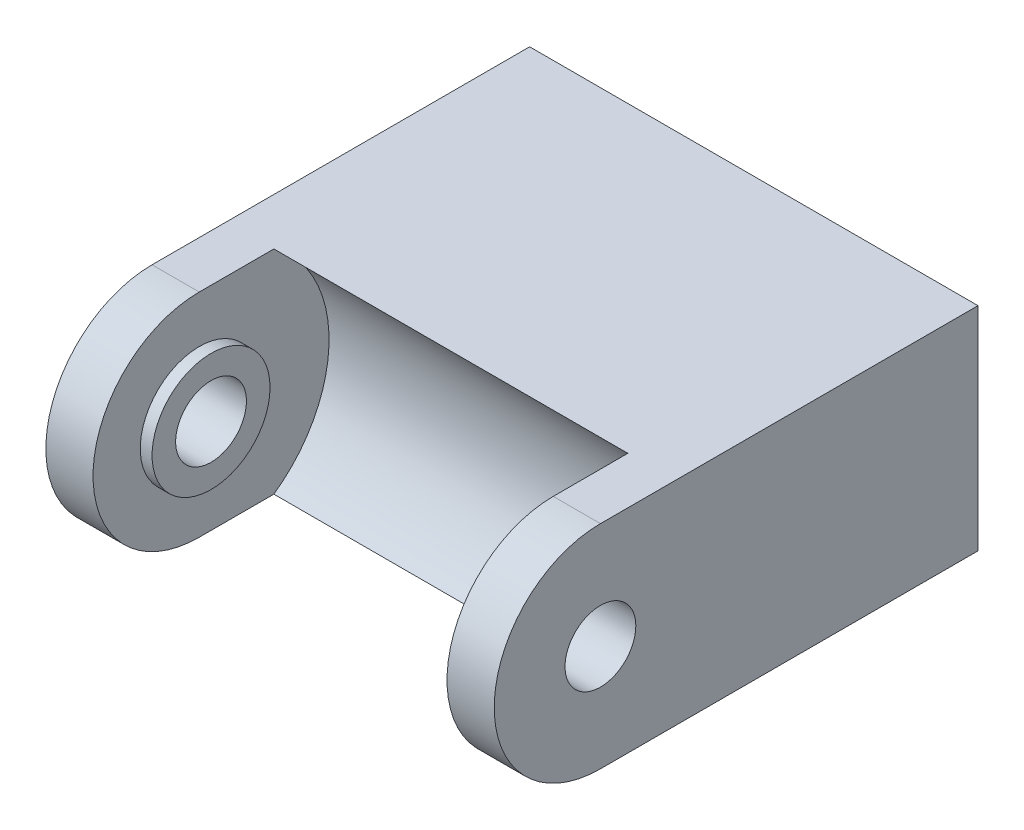
from build123d import *
from build123d.topology import SkipClean

# Parameters (mm, degrees)
EXTRUDE_1_DEPTH          = 9.5
EXTRUDE_1_DEPTH_BACK     = 9.5
CUT_EXTRUDE_1_DEPTH      = 7
CUT_EXTRUDE_1_DEPTH_BACK = 7
SKETCH_2_R               = 5.5
CUT_EXTRUDE_2_DEPTH      = 20.144189719
CUT_EXTRUDE_2_DEPTH_BACK = 20.144189719
SKETCH_3_R               = 1.5
CUT_EXTRUDE_3_DEPTH      = 7.5
CUT_EXTRUDE_3_DEPTH_BACK = 7.5
SKETCH_4_R               = 5.5
SKETCH_4_R_2             = 2.5
SKETCH_5_R               = 1.75
CUT_EXTRUDE_4_DEPTH      = 2


with BuildPart() as part:
    # Эскиз1 → Бобышка-Вытянуть1 (new, two sides: drawn at the far end of the back side and taken through both)
    with BuildSketch(Plane(origin=(0, 0, 0), x_dir=(0, 0, -1), z_dir=(1, 0, 0)).offset(-EXTRUDE_1_DEPTH_BACK)):
        with BuildLine():
            Line((16, 4.5), (0, 4.5))
            ThreePointArc((0, 4.5), (-4.5, 0), (0, -4.5))
            Line((0, -4.5), (16, -4.5))
            Line((16, -4.5), (16, 4.5))
        make_face()
    extrude(amount=EXTRUDE_1_DEPTH + EXTRUDE_1_DEPTH_BACK)

    # Эскиз2 → Вырез-Вытянуть1 (cut, two sides: drawn at the far end of the back side and taken through both)
    with BuildSketch(Plane(origin=(0, 0, 0), x_dir=(0, 0, -1), z_dir=(1, 0, 0)).offset(-CUT_EXTRUDE_1_DEPTH_BACK)):
        Circle(SKETCH_2_R)
    extrude(amount=CUT_EXTRUDE_1_DEPTH + CUT_EXTRUDE_1_DEPTH_BACK, mode=Mode.SUBTRACT)

    # Эскиз3 → Вырез-Вытянуть2 (cut, two sides: drawn at the far end of the back side and taken through both)
    with BuildSketch(Plane(origin=(0, 0, 0), x_dir=(0, 0, -1), z_dir=(1, 0, 0)).offset(-CUT_EXTRUDE_2_DEPTH_BACK)):
        Circle(SKETCH_3_R)
    extrude(amount=CUT_EXTRUDE_2_DEPTH + CUT_EXTRUDE_2_DEPTH_BACK, mode=Mode.SUBTRACT)

    # Эскиз4 → Вырез-Вытянуть3 (cut, two sides: drawn at the far end of the back side and taken through both)
    with SkipClean():  # the faces are left unmerged after this step: merging them gives an invalid solid
        with BuildSketch(Plane(origin=(0, 0, 0), x_dir=(0, 0, -1), z_dir=(1, 0, 0)).offset(-CUT_EXTRUDE_3_DEPTH_BACK)):
            Circle(SKETCH_4_R)
            Circle(SKETCH_4_R_2, mode=Mode.SUBTRACT)
        extrude(amount=CUT_EXTRUDE_3_DEPTH + CUT_EXTRUDE_3_DEPTH_BACK, mode=Mode.SUBTRACT)
    add(part.part.scale(1), mode=Mode.REPLACE)  # the faces are merged on a copy

    # Эскиз5 → Вырез-Вытянуть4 (cut)
    with BuildSketch(Plane(origin=(0, 0, -16), x_dir=(-1, 0, 0), z_dir=(0, 0, -1))):
        Circle(SKETCH_5_R)
    extrude(amount=-CUT_EXTRUDE_4_DEPTH, mode=Mode.SUBTRACT)


solid = part.part
